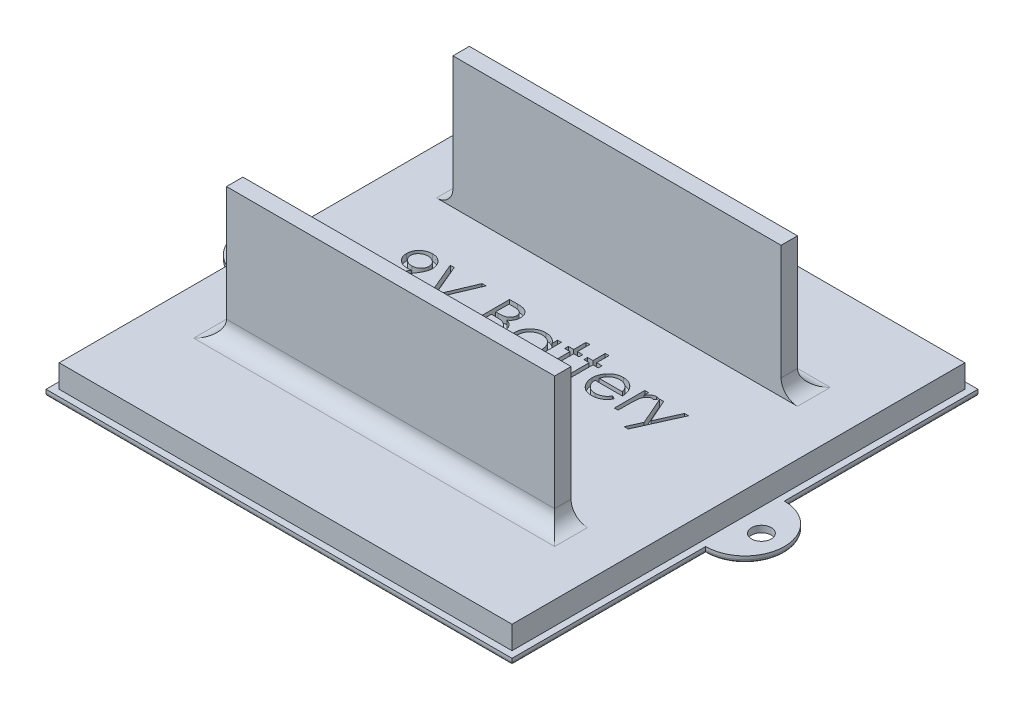
from build123d import *

# Parameters (mm, degrees)
SKETCH1_W            = 71
SKETCH1_H            = 71
BOSS_EXTRUDE1_DEPTH  = 4.5
TEXT_2_W             = 0.569871795
TEXT_2_H             = 6.512820513
CUT_EXTRUDE1_DEPTH   = 1
BOSS_EXTRUDE3_DEPTH  = 4.5
SKETCH5_R            = 1.5
CUT_EXTRUDE2_DEPTH   = 4.5
SKETCH61_W           = 89
SKETCH61_H           = 89
SKETCH61_W_2         = 69
SKETCH61_H_2         = 69
CUT_EXTRUDE21_DEPTH  = 3.5
SKETCH9_W            = 50
SKETCH9_H            = 2.5
TOP_TRACK_DEPTH      = 20
FILLET1_R            = 2.5
FILLET1_OF_MIRROR4_R = 2.5
FILLET2_R            = 0.5


with BuildPart() as part:
    # Sketch1 → Boss-Extrude1 (new body)
    with BuildSketch(Plane(origin=(0, 0, 0), x_dir=(1, 0, 0), z_dir=(0, 1, 0))):
        Rectangle(SKETCH1_W, SKETCH1_H)
    extrude(amount=BOSS_EXTRUDE1_DEPTH)

    # text 2 → Cut-Extrude1 (cut)
    # profile 1 of 15: a face of its own
    with BuildSketch(Plane(origin=(0, 4.5, 0), x_dir=(1, 0, 0), z_dir=(0, 1, 0))):
        with BuildLine():
            Line((-21.152394286, 1.65489819), (-21.607782908, 1.971634969))
            Line((-21.607782908, 1.971634969), (-19.842197972, 4.552594504))
            add(Edge.make_bspline(
                [(-19.842197972, 4.552594504), (-19.954848307, 4.538818518), (-20.176663096, 4.511692833), (-20.400068981, 4.506709616), (-20.510016482, 4.504257164)],
                knots=[0, 0, 0, 0, 1.015715272, 2, 2, 2, 2], degree=3))
            add(Edge.make_bspline(
                [(-20.510016482, 4.504257164), (-20.576677054, 4.505964546), (-20.707525928, 4.509315987), (-20.899897641, 4.53588041), (-21.084747158, 4.576792785), (-21.261584418, 4.63784124), (-21.431074091, 4.71371142), (-21.592846171, 4.807794859), (-21.746682887, 4.918477702), (-21.890932045, 5.045174701), (-22.0221262, 5.184290596), (-22.139008468, 5.33153012), (-22.236147379, 5.488603667), (-22.316840613, 5.652307065), (-22.378037293, 5.82499323), (-22.422600754, 6.004697142), (-22.450037025, 6.192678264), (-22.453301099, 6.320631001), (-22.454958389, 6.385597308)],
                knots=[0, 0, 0, 0, 1.060718605, 2.082097864, 3.085795603, 4.069760067, 5.054557537, 6.03741023, 7.043284206, 8.066802108, 9.088538119, 10.083643548, 11.053783639, 12.022749082, 12.983451788, 13.964007469, 14.966251758, 16, 16, 16, 16], degree=3))
            add(Edge.make_bspline(
                [(-22.454958389, 6.385597308), (-22.451811628, 6.474440436), (-22.445635176, 6.648821471), (-22.395926438, 6.903608452), (-22.314174108, 7.144521181), (-22.200185482, 7.370926248), (-22.056612487, 7.579566817), (-21.884058331, 7.767542437), (-21.683572567, 7.932179529), (-21.459722332, 8.073701212), (-21.217781852, 8.187520421), (-20.964383001, 8.271411724), (-20.701467383, 8.320758023), (-20.523363181, 8.3272638), (-20.433694366, 8.330539216)],
                knots=[0, 0, 0, 0, 1.022988612, 2.007919123, 2.978103895, 3.94594894, 4.918897164, 5.887013414, 6.875921846, 7.89917871, 8.930658928, 9.948724884, 10.967259574, 12, 12, 12, 12], degree=3))
            add(Edge.make_bspline(
                [(-20.433694366, 8.330539216), (-20.345722519, 8.327218777), (-20.171898441, 8.320657903), (-19.91628553, 8.272608416), (-19.67146397, 8.191624738), (-19.438790923, 8.079711316), (-19.223363704, 7.939429097), (-19.029641875, 7.772270747), (-18.862046254, 7.578132148), (-18.720851499, 7.361708744), (-18.607512997, 7.129177221), (-18.525738998, 6.886454962), (-18.475400482, 6.635287568), (-18.469057145, 6.465117593), (-18.465855825, 6.379237132)],
                knots=[0, 0, 0, 0, 1.026385292, 2.028040595, 3.023318987, 4.028184125, 5.03290303, 6.015178782, 7.004435299, 8.016004309, 9.023023918, 10.015172535, 10.998308025, 12, 12, 12, 12], degree=3))
            add(Edge.make_bspline(
                [(-18.465855825, 6.379237132), (-18.467993795, 6.31257344), (-18.472330133, 6.177362817), (-18.502694576, 5.971930623), (-18.554256912, 5.762469107), (-18.612770709, 5.585174212), (-18.669253356, 5.438746024), (-18.72241398, 5.323082443), (-18.781400316, 5.20134158), (-18.85019579, 5.074799981), (-18.924150243, 4.941844525), (-19.007714931, 4.803808741), (-19.098983611, 4.660507396), (-19.163988959, 4.563901965), (-19.197276097, 4.514433446)],
                knots=[0, 0, 0, 0, 1.179839688, 2.393009684, 3.667231171, 4.993948276, 5.694988576, 6.444077775, 7.246288328, 8.089075292, 8.993003841, 9.939041771, 10.944649915, 12, 12, 12, 12], degree=3))
            Line((-19.197276097, 4.514433446), (-21.152394286, 1.65489819))
        make_face()
        with BuildLine():
            add(Edge.make_bspline(
                [(-20.404437555, 5.155539216), (-20.353938701, 5.156918769), (-20.2556346, 5.15960429), (-20.1116215, 5.175949629), (-19.975687588, 5.204931004), (-19.84746975, 5.24651391), (-19.725682371, 5.29669101), (-19.61225989, 5.360575613), (-19.507107382, 5.436805793), (-19.409520714, 5.52245825), (-19.322863172, 5.617618595), (-19.245677959, 5.717217631), (-19.180072358, 5.821692566), (-19.128250412, 5.932351771), (-19.085642683, 6.046501563), (-19.056218575, 6.165980179), (-19.039918428, 6.290165135), (-19.037139713, 6.374526986), (-19.035727619, 6.41739819)],
                knots=[0, 0, 0, 0, 1.163407946, 2.26475976, 3.333800367, 4.359385343, 5.366239384, 6.363380779, 7.350133999, 8.353570782, 9.349036268, 10.310270964, 11.253520213, 12.184142, 13.120487599, 14.056272588, 15.012232024, 16, 16, 16, 16], degree=3))
            add(Edge.make_bspline(
                [(-19.035727619, 6.41739819), (-19.036942591, 6.460287297), (-19.039336841, 6.544805543), (-19.058545227, 6.669174357), (-19.092336703, 6.788360701), (-19.137676583, 6.903017081), (-19.1974033, 7.01220147), (-19.26907391, 7.117284666), (-19.354222783, 7.217600384), (-19.452198867, 7.310789325), (-19.557852985, 7.396691943), (-19.670448464, 7.472503823), (-19.78905724, 7.536042279), (-19.9129557, 7.588473268), (-20.04240199, 7.629388632), (-20.177319512, 7.658811565), (-20.318390033, 7.675088891), (-20.414150367, 7.677850043), (-20.462951177, 7.679257164)],
                knots=[0, 0, 0, 0, 0.972161553, 1.915763587, 2.844109794, 3.775983486, 4.705125789, 5.659731448, 6.655561913, 7.682237399, 8.721216875, 9.739758359, 10.754845918, 11.767244016, 12.7857855, 13.828538656, 14.893392813, 16, 16, 16, 16], degree=3))
            add(Edge.make_bspline(
                [(-20.462951177, 7.679257164), (-20.51132757, 7.67784777), (-20.606241653, 7.675082549), (-20.746058057, 7.658842505), (-20.880063319, 7.629190755), (-21.009134544, 7.58849222), (-21.133029323, 7.536038368), (-21.251632505, 7.472500494), (-21.364254321, 7.396709394), (-21.469807143, 7.310721735), (-21.56795623, 7.218034148), (-21.651641118, 7.116845213), (-21.723475751, 7.012256133), (-21.783120399, 6.903002554), (-21.828482109, 6.788364578), (-21.86226774, 6.669173306), (-21.881477697, 6.544805816), (-21.883871732, 6.460287389), (-21.885086594, 6.41739819)],
                knots=[0, 0, 0, 0, 1.099389452, 2.15699305, 3.192601482, 4.213358962, 5.227959689, 6.245255729, 7.266013209, 8.307253147, 9.336162325, 10.327954924, 11.284637477, 12.215801273, 13.149702402, 14.080068371, 15.025723358, 16, 16, 16, 16], degree=3))
            add(Edge.make_bspline(
                [(-21.885086594, 6.41739819), (-21.883987271, 6.374493601), (-21.881819204, 6.289877898), (-21.8609045, 6.165551443), (-21.825928192, 6.046374291), (-21.779084441, 5.931187637), (-21.717395842, 5.821111551), (-21.64169686, 5.716667909), (-21.552968227, 5.616672735), (-21.452396042, 5.52267965), (-21.342326664, 5.436406418), (-21.224766854, 5.361058439), (-21.101740435, 5.297427004), (-20.972814334, 5.246370493), (-20.838943997, 5.205346475), (-20.698926258, 5.176003043), (-20.55322417, 5.159761073), (-20.454508918, 5.156960003), (-20.404437555, 5.155539216)],
                knots=[0, 0, 0, 0, 0.952633368, 1.87876736, 2.791047057, 3.707742249, 4.635551637, 5.587206343, 6.568248508, 7.601284464, 8.641511608, 9.671105535, 10.699146789, 11.713763218, 12.747829548, 13.806491675, 14.887386225, 16, 16, 16, 16], degree=3))
        make_face(mode=Mode.SUBTRACT)
    # profile 2 of 15: a face of its own
    with BuildSketch(Plane(origin=(0, 4.5, 0), x_dir=(1, 0, 0), z_dir=(0, 1, 0))):
        Polygon((-17.570343004, 8.167718703), (-16.959766081, 8.167718703), (-14.843099414, 3.163532004), (-12.726432748, 8.167718703), (-12.115855825, 8.167718703), (-14.802394286, 1.817718703), (-14.883804543, 1.817718703), align=None)
    # profile 3 of 15: a face of its own
    with BuildSketch(Plane(origin=(0, 4.5, 0), x_dir=(1, 0, 0), z_dir=(0, 1, 0))):
        with BuildLine():
            Line((-8.533804543, 8.167718703), (-7.294842203, 8.167718703))
            add(Edge.make_bspline(
                [(-7.294842203, 8.167718703), (-7.234193392, 8.167399841), (-7.116640904, 8.166781808), (-6.945699916, 8.157196699), (-6.78559136, 8.144127184), (-6.636268801, 8.12338973), (-6.497801241, 8.098367506), (-6.369771385, 8.068065639), (-6.252586358, 8.03173164), (-6.112681822, 7.973953387), (-5.953168623, 7.888095639), (-5.780451539, 7.761225242), (-5.632760991, 7.606044916), (-5.505422958, 7.430997813), (-5.404183784, 7.238437198), (-5.330942345, 7.03295267), (-5.284573056, 6.817194653), (-5.279804326, 6.669070601), (-5.277394286, 6.594211091)],
                knots=[0, 0, 0, 0, 1.001505555, 1.941167018, 2.826882275, 3.653841531, 4.429895133, 5.150066043, 5.825578002, 6.45369114, 7.647487171, 8.808567382, 9.977351308, 11.170798116, 12.373658725, 13.556498008, 14.765093433, 16, 16, 16, 16], degree=3))
            add(Edge.make_bspline(
                [(-5.277394286, 6.594211091), (-5.279377697, 6.524084311), (-5.283275286, 6.386278576), (-5.32054572, 6.18472212), (-5.378894362, 5.992859195), (-5.460002457, 5.81139001), (-5.565416078, 5.64441474), (-5.690344742, 5.490586415), (-5.841069798, 5.356418068), (-5.953996819, 5.281410231), (-6.011358629, 5.243309648)],
                knots=[0, 0, 0, 0, 1.044552857, 2.05264487, 3.044412934, 4.028983338, 5.005914585, 5.980388656, 6.974128949, 8, 8, 8, 8], degree=3))
            add(Edge.make_bspline(
                [(-6.011358629, 5.243309648), (-5.939221853, 5.215614579), (-5.801206332, 5.16262705), (-5.611275995, 5.068945566), (-5.447636776, 4.967051451), (-5.309030525, 4.855777951), (-5.190489352, 4.73583768), (-5.086979015, 4.605471973), (-4.998657093, 4.462980227), (-4.922977932, 4.309848098), (-4.863925189, 4.14763922), (-4.819700334, 3.977875098), (-4.79435939, 3.801164476), (-4.790753241, 3.680903859), (-4.788932748, 3.620192661)],
                knots=[0, 0, 0, 0, 1.27268992, 2.434971085, 3.483601985, 4.442670788, 5.356604649, 6.2567628, 7.179492994, 8.113709626, 9.066344395, 10.018646069, 10.999752585, 12, 12, 12, 12], degree=3))
            add(Edge.make_bspline(
                [(-4.788932748, 3.620192661), (-4.790705025, 3.558204193), (-4.794192032, 3.436240146), (-4.819918552, 3.257070116), (-4.863477932, 3.085846998), (-4.92347844, 2.92146331), (-5.001787211, 2.764237066), (-5.097087946, 2.613990144), (-5.210719497, 2.472232144), (-5.33783356, 2.337387857), (-5.481637738, 2.216143157), (-5.63678775, 2.10816466), (-5.805237502, 2.019362519), (-5.984220406, 1.944766309), (-6.175744236, 1.887784677), (-6.378948967, 1.84792015), (-6.593659343, 1.821059583), (-6.740997034, 1.818851226), (-6.816556946, 1.817718703)],
                knots=[0, 0, 0, 0, 0.978564426, 1.925352924, 2.850884081, 3.763762016, 4.682927383, 5.618979971, 6.567305752, 7.547517671, 8.540179244, 9.531824382, 10.526200242, 11.540722885, 12.589160233, 13.674978461, 14.80764778, 16, 16, 16, 16], degree=3))
            Line((-6.816556946, 1.817718703), (-8.533804543, 1.817718703))
            Line((-8.533804543, 1.817718703), (-8.533804543, 8.167718703))
        make_face()
        with BuildLine():
            Line((-7.963932748, 7.516436651), (-7.963932748, 5.481180241))
            Line((-7.963932748, 5.481180241), (-7.581050135, 5.481180241))
            add(Edge.make_bspline(
                [(-7.581050135, 5.481180241), (-7.525081607, 5.481905816), (-7.416939004, 5.483307774), (-7.260330048, 5.487323726), (-7.114960372, 5.498568748), (-6.981080904, 5.509810538), (-6.85890247, 5.528088718), (-6.74869575, 5.549845855), (-6.648731152, 5.572856269), (-6.533452263, 5.611989481), (-6.402691342, 5.669824691), (-6.263294139, 5.759580737), (-6.140404458, 5.866486349), (-6.036632418, 5.98984138), (-5.951703035, 6.125670031), (-5.892713866, 6.271805086), (-5.852713794, 6.424604468), (-5.849100587, 6.529503298), (-5.847266081, 6.582762773)],
                knots=[0, 0, 0, 0, 1.156816544, 2.235205308, 3.236616184, 4.169592532, 5.011045266, 5.787822928, 6.49130361, 7.128639758, 8.301311294, 9.436451833, 10.541879658, 11.654887649, 12.756523258, 13.837046038, 14.901820046, 16, 16, 16, 16], degree=3))
            add(Edge.make_bspline(
                [(-5.847266081, 6.582762773), (-5.848220722, 6.618006673), (-5.850093355, 6.687141431), (-5.865430061, 6.787923831), (-5.891496946, 6.882708924), (-5.924978307, 6.972795667), (-5.971766356, 7.055367167), (-6.026854354, 7.133278394), (-6.093412678, 7.203876094), (-6.169172374, 7.269860756), (-6.256273732, 7.328361542), (-6.35466479, 7.379598355), (-6.465676719, 7.420856621), (-6.587438613, 7.456990212), (-6.721824729, 7.482368974), (-6.867284276, 7.503511548), (-7.025008694, 7.514275238), (-7.134129095, 7.51570011), (-7.190535312, 7.516436651)],
                knots=[0, 0, 0, 0, 0.91205012, 1.789085906, 2.630437955, 3.453916878, 4.269457761, 5.079663411, 5.91843418, 6.774407191, 7.675494373, 8.627863946, 9.638891023, 10.736472738, 11.911756761, 13.175263542, 14.539845004, 16, 16, 16, 16], degree=3))
            Line((-7.190535312, 7.516436651), (-7.963932748, 7.516436651))
        make_face(mode=Mode.SUBTRACT)
        with BuildLine():
            Line((-7.963932748, 4.82989819), (-7.963932748, 2.469000754))
            Line((-7.963932748, 2.469000754), (-7.152374254, 2.469000754))
            add(Edge.make_bspline(
                [(-7.152374254, 2.469000754), (-7.094282774, 2.469696981), (-6.982319105, 2.471038868), (-6.820664016, 2.47541956), (-6.670834671, 2.485384117), (-6.533514767, 2.501070159), (-6.407221518, 2.518085345), (-6.293469971, 2.540965812), (-6.191338034, 2.567180355), (-6.07291179, 2.607700924), (-5.939555425, 2.670650236), (-5.7958443, 2.765563189), (-5.668071018, 2.878635476), (-5.559567191, 3.009501563), (-5.470643626, 3.151798399), (-5.405954443, 3.30264782), (-5.366056746, 3.459557277), (-5.36122681, 3.566539741), (-5.358804543, 3.620192661)],
                knots=[0, 0, 0, 0, 1.160039823, 2.235823828, 3.228722157, 4.157150951, 4.99529583, 5.772374946, 6.472645482, 7.099169577, 8.269452708, 9.405989375, 10.527446681, 11.663510218, 12.788923519, 13.866172445, 14.929861265, 16, 16, 16, 16], degree=3))
            add(Edge.make_bspline(
                [(-5.358804543, 3.620192661), (-5.359305475, 3.653744865), (-5.360299259, 3.720308072), (-5.375286375, 3.818126772), (-5.397082967, 3.912879428), (-5.425261426, 4.004823329), (-5.466299602, 4.092296168), (-5.514208619, 4.177027955), (-5.570381448, 4.259130696), (-5.657910149, 4.36293007), (-5.785222178, 4.482522365), (-5.966118756, 4.599611834), (-6.171808497, 4.694041426), (-6.320992662, 4.734136191), (-6.398057347, 4.75484811)],
                knots=[0, 0, 0, 0, 0.723448775, 1.435228256, 2.130040452, 2.821711965, 3.505591119, 4.210454504, 4.921174351, 5.648778258, 7.137944449, 8.670945889, 10.280296675, 12, 12, 12, 12], degree=3))
            add(Edge.make_bspline(
                [(-6.398057347, 4.75484811), (-6.428952992, 4.761116619), (-6.495941124, 4.774708041), (-6.605174877, 4.789054874), (-6.729881382, 4.801836626), (-6.870348602, 4.811291154), (-7.026754257, 4.821063883), (-7.199432381, 4.824864488), (-7.387677795, 4.829398859), (-7.518292527, 4.829727489), (-7.586138277, 4.82989819)],
                knots=[0, 0, 0, 0, 0.634451884, 1.375622551, 2.216452059, 3.157844607, 4.20941857, 5.370758133, 6.634282058, 8, 8, 8, 8], degree=3))
            Line((-7.586138277, 4.82989819), (-7.963932748, 4.82989819))
        make_face(mode=Mode.SUBTRACT)
    # profile 4 of 15: a face of its own
    with BuildSketch(Plane(origin=(0, 4.5, 0), x_dir=(1, 0, 0), z_dir=(0, 1, 0))):
        with BuildLine():
            Line((1.072605714, 6.458103318), (1.072605714, 1.817718703))
            Line((1.072605714, 1.817718703), (0.502733919, 1.817718703))
            Line((0.502733919, 1.817718703), (0.502733919, 2.62037295))
            add(Edge.make_bspline(
                [(0.502733919, 2.62037295), (0.438474113, 2.547729686), (0.313070294, 2.405965444), (0.103627123, 2.220759217), (-0.118383714, 2.067672834), (-0.351884683, 1.944029415), (-0.596664924, 1.851152399), (-0.852181825, 1.78513751), (-1.118539616, 1.742694409), (-1.300426031, 1.738456198), (-1.392598613, 1.736308446)],
                knots=[0, 0, 0, 0, 1.074387032, 2.096679803, 3.090159297, 4.057316773, 5.018401886, 5.985159533, 6.978961417, 8, 8, 8, 8], degree=3))
            add(Edge.make_bspline(
                [(-1.392598613, 1.736308446), (-1.474546186, 1.738533436), (-1.63615043, 1.742921214), (-1.873874612, 1.776961394), (-2.102641979, 1.83162695), (-2.322668704, 1.907647135), (-2.532531025, 2.008486626), (-2.734025772, 2.129211462), (-2.926109084, 2.272976968), (-3.105853162, 2.437329533), (-3.271374077, 2.615846153), (-3.4166281, 2.806247359), (-3.53773726, 3.007709825), (-3.639010835, 3.217682833), (-3.717018488, 3.437782758), (-3.771399225, 3.667248477), (-3.805399749, 3.905808676), (-3.809785714, 4.068258954), (-3.812009671, 4.150631363)],
                knots=[0, 0, 0, 0, 1.033919861, 2.038935746, 3.024066025, 3.998881131, 4.97069526, 5.957263378, 6.95902576, 7.993208707, 9.027059324, 10.027763471, 11.009749337, 11.988697705, 12.965288445, 13.950418724, 14.960734635, 16, 16, 16, 16], degree=3))
            add(Edge.make_bspline(
                [(-3.812009671, 4.150631363), (-3.809736423, 4.231301225), (-3.805242334, 4.390781191), (-3.771762921, 4.625329686), (-3.715463805, 4.851241387), (-3.636455567, 5.067788984), (-3.535142306, 5.275234504), (-3.411901348, 5.473724664), (-3.266723793, 5.663806285), (-3.099351569, 5.841009796), (-2.918041343, 6.004695768), (-2.72407836, 6.146952179), (-2.52228755, 6.26980989), (-2.309538945, 6.367152626), (-2.088981483, 6.445909144), (-1.85865166, 6.500397529), (-1.619507796, 6.532505526), (-1.457146475, 6.537155113), (-1.374790119, 6.539513575)],
                knots=[0, 0, 0, 0, 1.020392517, 2.01726096, 2.990465484, 3.961182959, 4.928053699, 5.906110375, 6.912531644, 7.948652711, 8.985773172, 9.998621852, 10.987621588, 11.969261332, 12.953316658, 13.946091881, 14.958173133, 16, 16, 16, 16], degree=3))
            add(Edge.make_bspline(
                [(-1.374790119, 6.539513575), (-1.280084661, 6.536905082), (-1.094371726, 6.531789953), (-0.822722338, 6.489221862), (-0.565738785, 6.417306357), (-0.321437318, 6.31948461), (-0.090695216, 6.189493345), (0.124303055, 6.025518273), (0.325807575, 5.828593548), (0.442611819, 5.677335741), (0.502733919, 5.59947952)],
                knots=[0, 0, 0, 0, 1.038897134, 2.037228247, 3.008116434, 3.962042015, 4.918381754, 5.904844433, 6.921570401, 8, 8, 8, 8], degree=3))
            Line((0.502733919, 5.59947952), (0.502733919, 6.458103318))
            Line((0.502733919, 6.458103318), (1.072605714, 6.458103318))
        make_face()
        with BuildLine():
            add(Edge.make_bspline(
                [(-1.367157908, 5.96964178), (-1.450459635, 5.966677894), (-1.614883995, 5.960827655), (-1.856263827, 5.915155743), (-2.087246736, 5.839165121), (-2.306677471, 5.735239386), (-2.511089807, 5.604558679), (-2.693776895, 5.446495597), (-2.856232939, 5.265362729), (-2.992863647, 5.061977472), (-3.104243548, 4.843940078), (-3.182560878, 4.616021454), (-3.234212227, 4.382332424), (-3.239489114, 4.223831551), (-3.242137876, 4.144271187)],
                knots=[0, 0, 0, 0, 1.031046209, 2.035121221, 3.029706178, 4.034933723, 5.034054252, 6.02443088, 7.017295772, 8.038157696, 9.050218397, 10.03989886, 11.016116709, 12, 12, 12, 12], degree=3))
            add(Edge.make_bspline(
                [(-3.242137876, 4.144271187), (-3.238754427, 4.065186278), (-3.23200079, 3.907326447), (-3.183467387, 3.673318829), (-3.102042474, 3.445346495), (-2.990931875, 3.225344407), (-2.851800427, 3.021084682), (-2.690531014, 2.836499031), (-2.505564075, 2.677767921), (-2.300681313, 2.544894037), (-2.081863995, 2.437556321), (-1.851751005, 2.362870089), (-1.614668061, 2.314650402), (-1.453464541, 2.309017994), (-1.372246049, 2.306180241)],
                knots=[0, 0, 0, 0, 0.979072187, 1.954306742, 2.945804271, 3.96968567, 4.997920485, 5.998718438, 6.996577872, 8.005894225, 9.015743152, 10.005417472, 10.995077863, 12, 12, 12, 12], degree=3))
            add(Edge.make_bspline(
                [(-1.372246049, 2.306180241), (-1.289793108, 2.30919189), (-1.125802387, 2.315181761), (-0.883706446, 2.361049199), (-0.648765584, 2.436829733), (-0.424180184, 2.541875292), (-0.214963775, 2.672063638), (-0.027189054, 2.824476503), (0.131589917, 3.001737994), (0.266196509, 3.196549559), (0.371743336, 3.410112752), (0.448625615, 3.637504784), (0.494080558, 3.87873357), (0.499809582, 4.043586695), (0.502733919, 4.127734728)],
                knots=[0, 0, 0, 0, 1.01762866, 2.023962475, 3.030623092, 4.058876274, 5.077231937, 6.066672613, 7.034107872, 8.005628644, 8.981990164, 9.965428785, 10.961468474, 12, 12, 12, 12], degree=3))
            add(Edge.make_bspline(
                [(0.502733919, 4.127734728), (0.500992828, 4.191847649), (0.49756581, 4.318042167), (0.471384634, 4.503330663), (0.429737839, 4.680647566), (0.371052645, 4.850179302), (0.293961315, 5.010988544), (0.200983225, 5.164229938), (0.090483338, 5.309106478), (-0.035759554, 5.443623193), (-0.173944993, 5.566316917), (-0.320166516, 5.675834897), (-0.476156529, 5.765803099), (-0.639291724, 5.840263691), (-0.809855145, 5.899516721), (-0.989234698, 5.939045822), (-1.175523718, 5.966188119), (-1.302607275, 5.968478438), (-1.367157908, 5.96964178)],
                knots=[0, 0, 0, 0, 1.050140795, 2.067009409, 3.05949893, 4.030605086, 5.00011959, 5.97591094, 6.962425594, 7.979863591, 8.993523472, 9.986985069, 10.967611495, 11.937549037, 12.921786183, 13.919465291, 14.943216303, 16, 16, 16, 16], degree=3))
        make_face(mode=Mode.SUBTRACT)
    # profile 5 of 15: a face of its own
    with BuildSketch(Plane(origin=(0, 4.5, 0), x_dir=(1, 0, 0), z_dir=(0, 1, 0))):
        Polygon((2.945041611, 8.330539216), (3.514913406, 8.330539216), (3.514913406, 6.458103318), (4.32901597, 6.458103318), (4.32901597, 5.888231523), (3.514913406, 5.888231523), (3.514913406, 1.817718703), (2.945041611, 1.817718703), (2.945041611, 5.888231523), (2.130939047, 5.888231523), (2.130939047, 6.458103318), (2.945041611, 6.458103318), align=None)
    # profile 6 of 15: a face of its own
    with BuildSketch(Plane(origin=(0, 4.5, 0), x_dir=(1, 0, 0), z_dir=(0, 1, 0))):
        Polygon((5.875810842, 8.330539216), (6.445682637, 8.330539216), (6.445682637, 6.458103318), (7.259785201, 6.458103318), (7.259785201, 5.888231523), (6.445682637, 5.888231523), (6.445682637, 1.817718703), (5.875810842, 1.817718703), (5.875810842, 5.888231523), (5.061708278, 5.888231523), (5.061708278, 6.458103318), (5.875810842, 6.458103318), align=None)
    # profile 7 of 15: a face of its own
    with BuildSketch(Plane(origin=(0, 4.5, 0), x_dir=(1, 0, 0), z_dir=(0, 1, 0))):
        with BuildLine():
            Line((12.045181836, 3.283103318), (12.551451868, 3.01724795))
            add(Edge.make_bspline(
                [(12.551451868, 3.01724795), (12.511108331, 2.945686477), (12.432615784, 2.806456191), (12.29763157, 2.615172672), (12.156131667, 2.443091816), (12.001728753, 2.294810872), (11.839042336, 2.165540502), (11.667170234, 2.052441877), (11.485217664, 1.956069705), (11.293176021, 1.874875833), (11.089432549, 1.812447179), (10.873493512, 1.768352378), (10.644945228, 1.741095877), (10.488288587, 1.737929693), (10.408072461, 1.736308446)],
                knots=[0, 0, 0, 0, 1.120438281, 2.179929193, 3.190490725, 4.156257408, 5.095198341, 6.022838206, 6.959905092, 7.901321166, 8.864066838, 9.862729781, 10.905609505, 12, 12, 12, 12], degree=3))
            add(Edge.make_bspline(
                [(10.408072461, 1.736308446), (10.318914873, 1.73838975), (10.144994248, 1.742449771), (9.891829278, 1.777451814), (9.653469476, 1.834551664), (9.429928243, 1.914317718), (9.221753014, 2.018507292), (9.028530034, 2.14543378), (8.84924318, 2.294445157), (8.689542115, 2.466832133), (8.54577107, 2.651312255), (8.418905654, 2.843546503), (8.312847172, 3.04305121), (8.226573151, 3.248556304), (8.156895753, 3.458766511), (8.108333305, 3.675594459), (8.080339333, 3.898453304), (8.076049554, 4.049215614), (8.073887765, 4.125190658)],
                knots=[0, 0, 0, 0, 1.145258523, 2.234067595, 3.276747158, 4.290159414, 5.277019952, 6.260822364, 7.254936242, 8.264827045, 9.274100331, 10.257902744, 11.220704747, 12.172965371, 13.118907548, 14.062713208, 15.023725156, 16, 16, 16, 16], degree=3))
            add(Edge.make_bspline(
                [(8.073887765, 4.125190658), (8.07580935, 4.196482707), (8.079617678, 4.337774135), (8.103622106, 4.546898765), (8.14616401, 4.750150386), (8.204541054, 4.947697885), (8.279926887, 5.139210499), (8.372151056, 5.324804786), (8.481357227, 5.504283254), (8.565671935, 5.617500368), (8.608142573, 5.6745296)],
                knots=[0, 0, 0, 0, 1.024358464, 2.0301432, 3.019427413, 4.004406732, 4.986367066, 5.972626655, 6.978780325, 8, 8, 8, 8], degree=3))
            add(Edge.make_bspline(
                [(8.608142573, 5.6745296), (8.665669369, 5.74323455), (8.778900658, 5.878468052), (8.970410045, 6.056156157), (9.177783259, 6.205007006), (9.398421494, 6.328391382), (9.634889097, 6.422142141), (9.884007383, 6.492005898), (10.148612946, 6.531154575), (10.329506704, 6.536684216), (10.422064848, 6.539513575)],
                knots=[0, 0, 0, 0, 1.030682036, 2.02871468, 2.997146059, 3.962720338, 4.930598197, 5.918074684, 6.934738563, 8, 8, 8, 8], degree=3))
            add(Edge.make_bspline(
                [(10.422064848, 6.539513575), (10.51721979, 6.537056943), (10.703892093, 6.532237592), (10.976093227, 6.487558387), (11.233650527, 6.416705895), (11.476460927, 6.316641161), (11.704549046, 6.187537403), (11.916432308, 6.027622919), (12.115734338, 5.841807246), (12.231682759, 5.698908281), (12.29068464, 5.62619226)],
                knots=[0, 0, 0, 0, 1.056321875, 2.072262726, 3.055038591, 4.01806755, 4.982017516, 5.957941055, 6.960871419, 8, 8, 8, 8], degree=3))
            add(Edge.make_bspline(
                [(12.29068464, 5.62619226), (12.330829228, 5.571394334), (12.41085119, 5.462163233), (12.511085214, 5.284052705), (12.598093631, 5.097706341), (12.667640575, 4.900111945), (12.723955098, 4.693610707), (12.764698184, 4.476726376), (12.788591634, 4.249523536), (12.793288271, 4.094716786), (12.795682637, 4.015795626)],
                knots=[0, 0, 0, 0, 0.94817472, 1.890038105, 2.849395472, 3.817997239, 4.812318967, 5.836947057, 6.897266129, 8, 8, 8, 8], degree=3))
            Line((12.795682637, 4.015795626), (8.64375956, 4.015795626))
            add(Edge.make_bspline(
                [(8.64375956, 4.015795626), (8.646552846, 3.954653355), (8.65204573, 3.834419545), (8.677654633, 3.658486839), (8.718020265, 3.490895204), (8.774751279, 3.332901685), (8.843452555, 3.182442739), (8.927609498, 3.040634472), (9.028011261, 2.908122799), (9.139999315, 2.783722421), (9.264653617, 2.672940754), (9.395795172, 2.573786817), (9.535302069, 2.490682377), (9.682074306, 2.423227435), (9.835874545, 2.370420261), (9.996751242, 2.334374358), (10.164387824, 2.310231464), (10.278661942, 2.307546929), (10.336838486, 2.306180241)],
                knots=[0, 0, 0, 0, 1.094153842, 2.151609401, 3.174256925, 4.172055639, 5.149267565, 6.128595816, 7.11444997, 8.118368179, 9.117203808, 10.09244225, 11.054858984, 12.015122123, 12.976791628, 13.957293641, 14.960065497, 16, 16, 16, 16], degree=3))
            add(Edge.make_bspline(
                [(10.336838486, 2.306180241), (10.393718426, 2.30728343), (10.506579136, 2.309472367), (10.67465612, 2.330757406), (10.840009263, 2.365174906), (11.00195419, 2.412146745), (11.157204153, 2.469436177), (11.300978222, 2.538565647), (11.433203756, 2.61503733), (11.556787396, 2.702503455), (11.676659055, 2.809561166), (11.795571852, 2.943157402), (11.92307378, 3.10115906), (12.00288347, 3.220077625), (12.045181836, 3.283103318)],
                knots=[0, 0, 0, 0, 0.99110716, 1.966546729, 2.947904876, 3.932708344, 4.903319531, 5.828989031, 6.710028674, 7.56322171, 8.463672341, 9.504779593, 10.677557249, 12, 12, 12, 12], degree=3))
        make_face()
        with BuildLine():
            add(Edge.make_bspline(
                [(12.225810842, 4.585667421), (12.20495268, 4.661255777), (12.164807433, 4.806739032), (12.080921458, 5.008198933), (11.986448805, 5.187246982), (11.874649379, 5.342512888), (11.747978262, 5.480404976), (11.601664859, 5.600907266), (11.43758831, 5.708707498), (11.256596726, 5.799698462), (11.064932344, 5.877150063), (10.86426111, 5.929084201), (10.659504838, 5.964661514), (10.521012633, 5.967974596), (10.451321659, 5.96964178)],
                knots=[0, 0, 0, 0, 1.154881502, 2.222775134, 3.210006277, 4.132804581, 5.035138423, 5.962687519, 6.919655026, 7.923214229, 8.944639381, 9.960483929, 10.97369054, 12, 12, 12, 12], degree=3))
            add(Edge.make_bspline(
                [(10.451321659, 5.96964178), (10.394444821, 5.968532033), (10.282011269, 5.966338296), (10.116365045, 5.945528205), (9.95728902, 5.911129629), (9.803609427, 5.864021779), (9.657340137, 5.801231886), (9.515472486, 5.727602318), (9.381613767, 5.63771973), (9.297900274, 5.569214379), (9.255608518, 5.534605722)],
                knots=[0, 0, 0, 0, 1.04873581, 2.073130211, 3.073294108, 4.04793562, 5.032784715, 6.005352987, 6.992311501, 8, 8, 8, 8], degree=3))
            add(Edge.make_bspline(
                [(9.255608518, 5.534605722), (9.225322135, 5.507220321), (9.164029878, 5.451798943), (9.082132074, 5.356314525), (9.003717788, 5.253350977), (8.932355304, 5.138969108), (8.866900254, 5.014471409), (8.80565001, 4.880907985), (8.750520376, 4.737265306), (8.719503148, 4.637166738), (8.703545217, 4.585667421)],
                knots=[0, 0, 0, 0, 0.879870761, 1.780643979, 2.707998968, 3.669668524, 4.684282772, 5.740141944, 6.837334558, 8, 8, 8, 8], degree=3))
            Line((8.703545217, 4.585667421), (12.225810842, 4.585667421))
        make_face(mode=Mode.SUBTRACT)
    # profile 8 of 15: a face of its own
    with BuildSketch(Plane(origin=(0, 4.5, 0), x_dir=(1, 0, 0), z_dir=(0, 1, 0))):
        with BuildLine():
            Line((13.772605714, 6.458103318), (14.342477509, 6.458103318))
            Line((14.342477509, 6.458103318), (14.342477509, 5.775020385))
            add(Edge.make_bspline(
                [(14.342477509, 5.775020385), (14.384548542, 5.838621674), (14.465009068, 5.960258644), (14.598745382, 6.12113009), (14.735729998, 6.25432596), (14.876618695, 6.360468059), (15.022447533, 6.439957574), (15.170016003, 6.498183509), (15.321645784, 6.532613781), (15.42353956, 6.537210563), (15.474588887, 6.539513575)],
                knots=[0, 0, 0, 0, 1.2804753, 2.448899062, 3.506932113, 4.484331642, 5.4025378, 6.288909075, 7.142734305, 8, 8, 8, 8], degree=3))
            add(Edge.make_bspline(
                [(15.474588887, 6.539513575), (15.514188079, 6.537353619), (15.595665991, 6.532909371), (15.719005833, 6.501684017), (15.846084667, 6.451831033), (15.927985855, 6.404949487), (15.970682637, 6.380509167)],
                knots=[0, 0, 0, 0, 0.901110191, 1.854092781, 2.881294221, 4, 4, 4, 4], degree=3))
            Line((15.970682637, 6.380509167), (15.657761964, 5.886959488))
            add(Edge.make_bspline(
                [(15.657761964, 5.886959488), (15.630349883, 5.899188257), (15.578316505, 5.9224008), (15.502198935, 5.949872733), (15.432019938, 5.966048752), (15.387309482, 5.968499339), (15.36646589, 5.96964178)],
                knots=[0, 0, 0, 0, 1.180555205, 2.24091978, 3.179933427, 4, 4, 4, 4], degree=3))
            add(Edge.make_bspline(
                [(15.36646589, 5.96964178), (15.320735488, 5.966593712), (15.227458723, 5.960376537), (15.090508274, 5.911501843), (14.957616916, 5.832534622), (14.8520769, 5.744957033), (14.770357384, 5.660506029), (14.712045832, 5.586758213), (14.658555705, 5.504065553), (14.607446877, 5.413841698), (14.560880886, 5.31454612), (14.517420272, 5.207170862), (14.478124906, 5.091591557), (14.455718035, 5.011068984), (14.444240329, 4.969822068)],
                knots=[0, 0, 0, 0, 1.125678352, 2.296057538, 3.5422874, 4.923748041, 5.663163013, 6.437101912, 7.23742474, 8.08941207, 8.991984279, 9.93940061, 10.944477711, 12, 12, 12, 12], degree=3))
            add(Edge.make_bspline(
                [(14.444240329, 4.969822068), (14.435654416, 4.933033482), (14.416637269, 4.851549559), (14.398146908, 4.714845807), (14.379877925, 4.553331454), (14.367002632, 4.366556921), (14.355068184, 4.15498863), (14.348337035, 3.918304272), (14.342707051, 3.656260906), (14.342556344, 3.47306458), (14.342477509, 3.377233927)],
                knots=[0, 0, 0, 0, 0.566838948, 1.255505196, 2.06880316, 3.007127437, 4.065329342, 5.249902469, 6.561414163, 8, 8, 8, 8], degree=3))
            Line((14.342477509, 3.377233927), (14.342477509, 1.817718703))
            Line((14.342477509, 1.817718703), (13.772605714, 1.817718703))
            Line((13.772605714, 1.817718703), (13.772605714, 6.458103318))
        make_face()
    # profile 9 of 15: a face of its own
    with BuildSketch(Plane(origin=(0, 4.5, 0), x_dir=(1, 0, 0), z_dir=(0, 1, 0))):
        Polygon((16.052092893, 6.458103318), (16.666485922, 6.458103318), (18.237449464, 2.904036812), (19.832581675, 6.458103318), (20.44824674, 6.458103318), (17.598887765, 0.108103318), (16.983222701, 0.108103318), (17.928344897, 2.213321667), align=None)
    # profile 10 of 15: a face of its own
    with BuildSketch(Plane(origin=(0, 4.5, 0), x_dir=(1, 0, 0), z_dir=(0, 1, 0))):
        Polygon((-13.052073773, -3.415614631), (-12.482201978, -3.415614631), (-12.482201978, -6.020742836), (-9.225791722, -6.020742836), (-9.225791722, -3.415614631), (-8.655919927, -3.415614631), (-8.655919927, -9.765614631), (-9.225791722, -9.765614631), (-9.225791722, -6.672024887), (-12.482201978, -6.672024887), (-12.482201978, -9.765614631), (-13.052073773, -9.765614631), align=None)
    # profile 11 of 15: a face of its own
    with BuildSketch(Plane(origin=(0, 4.5, 0), x_dir=(1, 0, 0), z_dir=(0, 1, 0))):
        with BuildLine():
            add(Edge.make_bspline(
                [(-4.94920919, -5.043819759), (-4.862139309, -5.045673761), (-4.691416552, -5.049309007), (-4.441393673, -5.088161873), (-4.202733212, -5.147574949), (-3.974521121, -5.229710497), (-3.759680128, -5.339804893), (-3.555080871, -5.471176036), (-3.361284297, -5.62681017), (-3.24512823, -5.747202665), (-3.186168325, -5.808312948)],
                knots=[0, 0, 0, 0, 1.054011418, 2.066658804, 3.057071809, 4.030435133, 4.997543892, 5.974964718, 6.972108034, 8, 8, 8, 8], degree=3))
            add(Edge.make_bspline(
                [(-3.186168325, -5.808312948), (-3.135401065, -5.866758322), (-3.034849032, -5.982517992), (-2.905915514, -6.170216032), (-2.794842112, -6.364598786), (-2.705827883, -6.568247507), (-2.635642197, -6.779384411), (-2.585811577, -6.998735202), (-2.556171709, -7.225815461), (-2.552174897, -7.38003671), (-2.550150696, -7.458142675)],
                knots=[0, 0, 0, 0, 1.025258237, 2.030674902, 3.01204498, 3.988269485, 4.97094183, 5.956517959, 6.965070386, 8, 8, 8, 8], degree=3))
            add(Edge.make_bspline(
                [(-2.550150696, -7.458142675), (-2.551931123, -7.536701352), (-2.555449328, -7.691936959), (-2.588729889, -7.920572094), (-2.640493431, -8.142268415), (-2.714574051, -8.35609776), (-2.809566621, -8.562713747), (-2.925482583, -8.761213929), (-3.063135374, -8.951989942), (-3.219171197, -9.133421849), (-3.391622458, -9.300637696), (-3.578704612, -9.446376127), (-3.776741216, -9.571238036), (-3.988365586, -9.671815533), (-4.211645169, -9.751117418), (-4.447061564, -9.806816019), (-4.694249049, -9.840492217), (-4.863027008, -9.8448167), (-4.94920919, -9.847024887)],
                knots=[0, 0, 0, 0, 0.998656419, 1.973391657, 2.932242238, 3.890759089, 4.846373663, 5.82037756, 6.809684879, 7.83454468, 8.860553229, 9.859544525, 10.845671541, 11.83227036, 12.833544569, 13.85385346, 14.904124723, 16, 16, 16, 16], degree=3))
            add(Edge.make_bspline(
                [(-4.94920919, -9.847024887), (-5.03581361, -9.844809288), (-5.205432741, -9.840469926), (-5.453492737, -9.806946856), (-5.689331045, -9.751143087), (-5.912902931, -9.671554922), (-6.125437154, -9.571234821), (-6.324621227, -9.446753613), (-6.511855359, -9.300594474), (-6.684343102, -9.13343356), (-6.840369143, -8.951986925), (-6.978024458, -8.761214712), (-7.093939764, -8.562713543), (-7.188932506, -8.356097814), (-7.263013081, -8.142268401), (-7.314776634, -7.920572098), (-7.348057192, -7.691936958), (-7.351575398, -7.536701351), (-7.353355825, -7.458142675)],
                knots=[0, 0, 0, 0, 1.099876186, 2.154163076, 3.173186993, 4.173200201, 5.163417411, 6.152872554, 7.150605724, 8.17532212, 9.198891216, 10.186952605, 11.159729845, 12.11414092, 13.071450619, 14.029093627, 15.002601286, 16, 16, 16, 16], degree=3))
            add(Edge.make_bspline(
                [(-7.353355825, -7.458142675), (-7.351317819, -7.380461228), (-7.347282917, -7.226665312), (-7.317672851, -7.000011931), (-7.268036613, -6.781032382), (-7.197766793, -6.570710447), (-7.10793209, -6.367954156), (-6.998419467, -6.173091105), (-6.868170748, -5.98624181), (-6.768018636, -5.870631751), (-6.717338196, -5.812129054)],
                knots=[0, 0, 0, 0, 1.031353054, 2.041901799, 3.029428768, 4.008703097, 4.981709435, 5.96992636, 6.972712378, 8, 8, 8, 8], degree=3))
            add(Edge.make_bspline(
                [(-6.717338196, -5.812129054), (-6.658467181, -5.750488807), (-6.542686971, -5.629262415), (-6.347925708, -5.474081978), (-6.143829775, -5.339977102), (-5.926614552, -5.232070254), (-5.698589939, -5.1470918), (-5.458706456, -5.088008651), (-5.207835163, -5.049448993), (-5.036276994, -5.04571487), (-4.94920919, -5.043819759)],
                knots=[0, 0, 0, 0, 1.027980169, 2.021703884, 2.998553061, 3.971491411, 4.943284454, 5.930300938, 6.949603206, 8, 8, 8, 8], degree=3))
        make_face()
        with BuildLine():
            add(Edge.make_bspline(
                [(-4.95175326, -5.613691554), (-5.013325784, -5.615441599), (-5.134881346, -5.618896511), (-5.31380545, -5.645174453), (-5.486054015, -5.686807781), (-5.651953832, -5.745960855), (-5.810945445, -5.822340286), (-5.963181075, -5.916154025), (-6.109108501, -6.026159532), (-6.245873102, -6.152184665), (-6.371389583, -6.28985084), (-6.481113912, -6.436532863), (-6.574413747, -6.58985152), (-6.652138036, -6.749966246), (-6.710026791, -6.918499625), (-6.752069275, -7.093543056), (-6.778322426, -7.275453169), (-6.781744855, -7.399116731), (-6.78348403, -7.461958781)],
                knots=[0, 0, 0, 0, 1.021534396, 2.016698045, 2.994645724, 3.958388632, 4.93408049, 5.916473867, 6.921342795, 7.962252576, 8.998418191, 10.008913653, 10.997312074, 11.973003931, 12.956656626, 13.948281152, 14.957379055, 16, 16, 16, 16], degree=3))
            add(Edge.make_bspline(
                [(-6.78348403, -7.461958781), (-6.780568793, -7.543151745), (-6.774782592, -7.704304595), (-6.727728663, -7.941633346), (-6.649013555, -8.169474706), (-6.542719491, -8.386493007), (-6.409539637, -8.58728414), (-6.252627387, -8.766302404), (-6.073666788, -8.920853805), (-5.874791138, -9.049089053), (-5.660062589, -9.150978896), (-5.432811835, -9.223185609), (-5.19579229, -9.270124251), (-5.033811535, -9.27478964), (-4.95175326, -9.277153092)],
                knots=[0, 0, 0, 0, 1.016792936, 2.018143844, 3.017858371, 4.030088057, 5.03801393, 6.028138512, 7.003788237, 7.991172063, 8.984598303, 9.972568034, 10.972917682, 12, 12, 12, 12], degree=3))
            add(Edge.make_bspline(
                [(-4.95175326, -9.277153092), (-4.869699705, -9.274775869), (-4.707728267, -9.270083298), (-4.471038046, -9.22342201), (-4.244408412, -9.150662512), (-4.029902894, -9.049203645), (-3.831117771, -8.920366836), (-3.650870079, -8.767175123), (-3.495297599, -8.586809993), (-3.362249487, -8.386227047), (-3.254214683, -8.169811152), (-3.175868017, -7.941591295), (-3.128700968, -7.704315304), (-3.122930036, -7.543155333), (-3.120022491, -7.461958781)],
                knots=[0, 0, 0, 0, 1.02726834, 2.027799167, 3.010890988, 4.004497153, 4.992059811, 5.971914811, 6.958719428, 7.966827853, 8.981595046, 9.981490638, 10.983022906, 12, 12, 12, 12], degree=3))
            add(Edge.make_bspline(
                [(-3.120022491, -7.461958781), (-3.121761067, -7.399116355), (-3.125182318, -7.275452054), (-3.151444039, -7.093547317), (-3.193454804, -6.918483992), (-3.251460453, -6.750023929), (-3.328847021, -6.589436956), (-3.423946059, -6.436983023), (-3.533222348, -6.289342718), (-3.660253411, -6.152629684), (-3.796875253, -6.026110404), (-3.942861823, -5.916111368), (-4.094871712, -5.822752588), (-4.253401427, -5.745307552), (-4.419322514, -5.687345948), (-4.591329734, -5.64493406), (-4.769490432, -5.61900756), (-4.89061041, -5.615474889), (-4.95175326, -5.613691554)],
                knots=[0, 0, 0, 0, 1.042956736, 2.052379634, 3.044323526, 4.02829302, 5.004299113, 5.996692471, 7.007513377, 8.048758398, 9.090003419, 10.095195979, 11.07790575, 12.047570684, 13.018257071, 13.989683339, 14.985167495, 16, 16, 16, 16], degree=3))
        make_face(mode=Mode.SUBTRACT)
    # profile 12 of 15: a face of its own
    with BuildSketch(Plane(origin=(0, 4.5, 0), x_dir=(1, 0, 0), z_dir=(0, 1, 0))):
        with Locations((-1.206881465, -6.509204375)):
            Rectangle(TEXT_2_W, TEXT_2_H)
    # profile 13 of 15: a face of its own
    with BuildSketch(Plane(origin=(0, 4.5, 0), x_dir=(1, 0, 0), z_dir=(0, 1, 0))):
        with BuildLine():
            Line((5.102413406, -3.252794118), (5.102413406, -9.765614631))
            Line((5.102413406, -9.765614631), (4.532541611, -9.765614631))
            Line((4.532541611, -9.765614631), (4.532541611, -8.962960384))
            add(Edge.make_bspline(
                [(4.532541611, -8.962960384), (4.468281805, -9.035603647), (4.342877986, -9.177367889), (4.133434815, -9.362574116), (3.911423978, -9.5156605), (3.67792301, -9.639303918), (3.433142768, -9.732180935), (3.177625867, -9.798195823), (2.911268076, -9.840638924), (2.729381661, -9.844877135), (2.637209079, -9.847024887)],
                knots=[0, 0, 0, 0, 1.074387032, 2.096679803, 3.090159297, 4.057316773, 5.018401886, 5.985159533, 6.978961417, 8, 8, 8, 8], degree=3))
            add(Edge.make_bspline(
                [(2.637209079, -9.847024887), (2.555261506, -9.844799897), (2.393657263, -9.840412119), (2.15593308, -9.80637194), (1.927165713, -9.751706383), (1.707138988, -9.675686198), (1.497276667, -9.574846707), (1.295781921, -9.454121872), (1.103698608, -9.310356366), (0.92395453, -9.1460038), (0.758433615, -8.96748718), (0.613179592, -8.777085974), (0.492070433, -8.575623508), (0.390796858, -8.3656505), (0.312789204, -8.145550575), (0.258408468, -7.916084856), (0.224407943, -7.677524657), (0.220021979, -7.515074379), (0.217798022, -7.43270197)],
                knots=[0, 0, 0, 0, 1.033919861, 2.038935746, 3.024066025, 3.998881131, 4.97069526, 5.957263378, 6.95902576, 7.993208707, 9.027059324, 10.027763471, 11.009749337, 11.988697705, 12.965288445, 13.950418724, 14.960734635, 16, 16, 16, 16], degree=3))
            add(Edge.make_bspline(
                [(0.217798022, -7.43270197), (0.22007127, -7.352032108), (0.224565358, -7.192552142), (0.258044772, -6.958003648), (0.314343887, -6.732091946), (0.393352125, -6.515544349), (0.494665386, -6.308098829), (0.617906344, -6.10960867), (0.763083899, -5.919527049), (0.930456123, -5.742323537), (1.111766349, -5.578637565), (1.305729332, -5.436381154), (1.507520143, -5.313523443), (1.720268748, -5.216180707), (1.940826209, -5.137424189), (2.171156032, -5.082935804), (2.410299896, -5.050827807), (2.572661218, -5.046178221), (2.655017573, -5.043819759)],
                knots=[0, 0, 0, 0, 1.020392517, 2.01726096, 2.990465484, 3.961182959, 4.928053699, 5.906110375, 6.912531644, 7.948652711, 8.985773172, 9.998621852, 10.987621588, 11.969261332, 12.953316658, 13.946091881, 14.958173133, 16, 16, 16, 16], degree=3))
            add(Edge.make_bspline(
                [(2.655017573, -5.043819759), (2.749753781, -5.046662919), (2.93571043, -5.052243726), (3.207669176, -5.09888242), (3.464912412, -5.177192213), (3.708921118, -5.28440068), (3.938240592, -5.423739186), (4.154551783, -5.592016813), (4.354092954, -5.793996064), (4.472151832, -5.945691347), (4.532541611, -6.023286906)],
                knots=[0, 0, 0, 0, 1.031072012, 2.023879775, 2.993683497, 3.952812103, 4.918022106, 5.908088563, 6.929940113, 8, 8, 8, 8], degree=3))
            Line((4.532541611, -6.023286906), (4.532541611, -3.252794118))
            Line((4.532541611, -3.252794118), (5.102413406, -3.252794118))
        make_face()
        with BuildLine():
            add(Edge.make_bspline(
                [(2.662649784, -5.613691554), (2.579348057, -5.616655439), (2.414923697, -5.622505678), (2.173543865, -5.668177591), (1.942560956, -5.744168212), (1.723130222, -5.848093947), (1.518717886, -5.978774655), (1.336030797, -6.136837736), (1.173574753, -6.317970604), (1.036944045, -6.521355862), (0.925564144, -6.739393256), (0.847246815, -6.967311879), (0.795595466, -7.20100091), (0.790318578, -7.359501783), (0.787669816, -7.439062147)],
                knots=[0, 0, 0, 0, 1.031046209, 2.035121221, 3.029706178, 4.034933723, 5.034054252, 6.02443088, 7.017295772, 8.038157696, 9.050218397, 10.03989886, 11.016116709, 12, 12, 12, 12], degree=3))
            add(Edge.make_bspline(
                [(0.787669816, -7.439062147), (0.791053266, -7.518147055), (0.797806902, -7.676006887), (0.846340305, -7.910014505), (0.927765218, -8.137986838), (1.038875818, -8.357988926), (1.178007265, -8.562248651), (1.339276678, -8.746834302), (1.524243617, -8.905565412), (1.72912638, -9.038439296), (1.947943697, -9.145777012), (2.178056687, -9.220463244), (2.415139631, -9.268682932), (2.576343151, -9.27431534), (2.657561643, -9.277153092)],
                knots=[0, 0, 0, 0, 0.979072187, 1.954306742, 2.945804271, 3.96968567, 4.997920485, 5.998718438, 6.996577872, 8.005894225, 9.015743152, 10.005417472, 10.995077863, 12, 12, 12, 12], degree=3))
            add(Edge.make_bspline(
                [(2.657561643, -9.277153092), (2.740014584, -9.274141443), (2.904005305, -9.268151572), (3.146101247, -9.222284134), (3.381042108, -9.1465036), (3.605627508, -9.041458041), (3.814843917, -8.911269696), (4.002618638, -8.758856831), (4.161397609, -8.581595339), (4.296004201, -8.386783775), (4.401551028, -8.173220581), (4.478433307, -7.945828549), (4.523888251, -7.704599763), (4.529617274, -7.539746639), (4.532541611, -7.455598605)],
                knots=[0, 0, 0, 0, 1.01762866, 2.023962475, 3.030623092, 4.058876274, 5.077231937, 6.066672613, 7.034107872, 8.005628644, 8.981990164, 9.965428785, 10.961468474, 12, 12, 12, 12], degree=3))
            add(Edge.make_bspline(
                [(4.532541611, -7.455598605), (4.53080052, -7.391485684), (4.527373503, -7.265291166), (4.501192327, -7.08000267), (4.459545531, -6.902685767), (4.400860337, -6.733154031), (4.323769007, -6.572344789), (4.230790917, -6.419103396), (4.12029103, -6.274226855), (3.994048139, -6.13971014), (3.8558627, -6.017016416), (3.709641176, -5.907498436), (3.553651164, -5.817530234), (3.390515968, -5.743069642), (3.219952547, -5.683816613), (3.040572994, -5.644287511), (2.854283975, -5.617145214), (2.727200417, -5.614854895), (2.662649784, -5.613691554)],
                knots=[0, 0, 0, 0, 1.050140795, 2.067009409, 3.05949893, 4.030605086, 5.00011959, 5.97591094, 6.962425594, 7.979863591, 8.993523472, 9.986985069, 10.967611495, 11.937549037, 12.921786183, 13.919465291, 14.943216303, 16, 16, 16, 16], degree=3))
        make_face(mode=Mode.SUBTRACT)
    # profile 14 of 15: a face of its own
    with BuildSketch(Plane(origin=(0, 4.5, 0), x_dir=(1, 0, 0), z_dir=(0, 1, 0))):
        with BuildLine():
            Line((10.213451066, -8.300230015), (10.719721098, -8.566085384))
            add(Edge.make_bspline(
                [(10.719721098, -8.566085384), (10.679377561, -8.637646856), (10.600885015, -8.776877143), (10.465900801, -8.968160661), (10.324400897, -9.140241517), (10.169997984, -9.288522461), (10.007311567, -9.417792831), (9.835439464, -9.530891456), (9.653486895, -9.627263629), (9.461445251, -9.708457501), (9.25770178, -9.770886154), (9.041762743, -9.814980955), (8.813214459, -9.842237457), (8.656557818, -9.845403641), (8.576341691, -9.847024887)],
                knots=[0, 0, 0, 0, 1.120438281, 2.179929193, 3.190490725, 4.156257408, 5.095198341, 6.022838206, 6.959905092, 7.901321166, 8.864066838, 9.862729781, 10.905609505, 12, 12, 12, 12], degree=3))
            add(Edge.make_bspline(
                [(8.576341691, -9.847024887), (8.487184104, -9.844943583), (8.313263479, -9.840883562), (8.060098509, -9.80588152), (7.821738707, -9.748781669), (7.598197474, -9.669015615), (7.390022244, -9.564826041), (7.196799265, -9.437899553), (7.017512411, -9.288888177), (6.857811346, -9.116501201), (6.714040301, -8.932021078), (6.587174885, -8.739786831), (6.481116403, -8.540282123), (6.394842382, -8.33477703), (6.325164984, -8.124566823), (6.276602535, -7.907738875), (6.248608564, -7.684880029), (6.244318784, -7.53411772), (6.242156996, -7.458142675)],
                knots=[0, 0, 0, 0, 1.145258523, 2.234067595, 3.276747158, 4.290159414, 5.277019952, 6.260822364, 7.254936242, 8.264827045, 9.274100331, 10.257902744, 11.220704747, 12.172965371, 13.118907548, 14.062713208, 15.023725156, 16, 16, 16, 16], degree=3))
            add(Edge.make_bspline(
                [(6.242156996, -7.458142675), (6.244078581, -7.386850626), (6.247886909, -7.245559199), (6.271891337, -7.036434568), (6.31443324, -6.833182947), (6.372810285, -6.635635448), (6.448196118, -6.444122834), (6.540420287, -6.258528547), (6.649626458, -6.079050079), (6.733941166, -5.965832965), (6.776411804, -5.908803733)],
                knots=[0, 0, 0, 0, 1.024358464, 2.0301432, 3.019427413, 4.004406732, 4.986367066, 5.972626655, 6.978780325, 8, 8, 8, 8], degree=3))
            add(Edge.make_bspline(
                [(6.776411804, -5.908803733), (6.8339386, -5.840098783), (6.947169888, -5.704865282), (7.138679276, -5.527177176), (7.346052489, -5.378326327), (7.566690725, -5.254941951), (7.803158328, -5.161191192), (8.052276613, -5.091327436), (8.316882177, -5.052178758), (8.497775935, -5.046649117), (8.590334079, -5.043819759)],
                knots=[0, 0, 0, 0, 1.030682036, 2.02871468, 2.997146059, 3.962720338, 4.930598197, 5.918074684, 6.934738563, 8, 8, 8, 8], degree=3))
            add(Edge.make_bspline(
                [(8.590334079, -5.043819759), (8.68548902, -5.04627639), (8.872161324, -5.051095741), (9.144362458, -5.095774946), (9.401919758, -5.166627438), (9.644730158, -5.266692172), (9.872818277, -5.395795931), (10.084701538, -5.555710415), (10.284003568, -5.741526087), (10.39995199, -5.884425053), (10.458953871, -5.957141073)],
                knots=[0, 0, 0, 0, 1.056321875, 2.072262726, 3.055038591, 4.01806755, 4.982017516, 5.957941055, 6.960871419, 8, 8, 8, 8], degree=3))
            add(Edge.make_bspline(
                [(10.458953871, -5.957141073), (10.499098459, -6.011938999), (10.579120421, -6.1211701), (10.679354445, -6.299280628), (10.766362862, -6.485626992), (10.835909805, -6.683221388), (10.892224329, -6.889722627), (10.932967414, -7.106606958), (10.956860865, -7.333809797), (10.961557502, -7.488616548), (10.963951868, -7.567537708)],
                knots=[0, 0, 0, 0, 0.94817472, 1.890038105, 2.849395472, 3.817997239, 4.812318967, 5.836947057, 6.897266129, 8, 8, 8, 8], degree=3))
            Line((10.963951868, -7.567537708), (6.812028791, -7.567537708))
            add(Edge.make_bspline(
                [(6.812028791, -7.567537708), (6.814822077, -7.628679978), (6.820314961, -7.748913788), (6.845923864, -7.924846494), (6.886289496, -8.09243813), (6.94302051, -8.250431649), (7.011721786, -8.400890594), (7.095878729, -8.542698861), (7.196280491, -8.675210534), (7.308268546, -8.799610913), (7.432922848, -8.910392579), (7.564064403, -9.009546516), (7.7035713, -9.092650956), (7.850343537, -9.160105899), (8.004143776, -9.212913072), (8.165020473, -9.248958975), (8.332657055, -9.273101869), (8.446931173, -9.275786405), (8.505107717, -9.277153092)],
                knots=[0, 0, 0, 0, 1.094153842, 2.151609401, 3.174256925, 4.172055639, 5.149267565, 6.128595816, 7.11444997, 8.118368179, 9.117203808, 10.09244225, 11.054858984, 12.015122123, 12.976791628, 13.957293641, 14.960065497, 16, 16, 16, 16], degree=3))
            add(Edge.make_bspline(
                [(8.505107717, -9.277153092), (8.561987656, -9.276049904), (8.674848367, -9.273860966), (8.842925351, -9.252575928), (9.008278494, -9.218158428), (9.17022342, -9.171186588), (9.325473384, -9.113897157), (9.469247453, -9.044767686), (9.601472987, -8.968296003), (9.725056627, -8.880829878), (9.844928286, -8.773772168), (9.963841083, -8.640175931), (10.091343011, -8.482174273), (10.171152701, -8.363255708), (10.213451066, -8.300230015)],
                knots=[0, 0, 0, 0, 0.99110716, 1.966546729, 2.947904876, 3.932708344, 4.903319531, 5.828989031, 6.710028674, 7.56322171, 8.463672341, 9.504779593, 10.677557249, 12, 12, 12, 12], degree=3))
        make_face()
        with BuildLine():
            add(Edge.make_bspline(
                [(10.394080073, -6.997665913), (10.373221911, -6.922077556), (10.333076664, -6.776594302), (10.249190689, -6.5751344), (10.154718036, -6.396086351), (10.042918609, -6.240820446), (9.916247493, -6.102928358), (9.76993409, -5.982426068), (9.60585754, -5.874625835), (9.424865957, -5.783634872), (9.233201575, -5.706183271), (9.032530341, -5.654249132), (8.827774069, -5.61867182), (8.689281864, -5.615358737), (8.61959089, -5.613691554)],
                knots=[0, 0, 0, 0, 1.154881502, 2.222775134, 3.210006277, 4.132804581, 5.035138423, 5.962687519, 6.919655026, 7.923214229, 8.944639381, 9.960483929, 10.97369054, 12, 12, 12, 12], degree=3))
            add(Edge.make_bspline(
                [(8.61959089, -5.613691554), (8.562714052, -5.614801301), (8.4502805, -5.616995037), (8.284634276, -5.637805129), (8.125558251, -5.672203705), (7.971878658, -5.719311554), (7.825609368, -5.782101447), (7.683741717, -5.855731016), (7.549882998, -5.945613603), (7.466169505, -6.014118954), (7.423877749, -6.048727611)],
                knots=[0, 0, 0, 0, 1.04873581, 2.073130211, 3.073294108, 4.04793562, 5.032784715, 6.005352987, 6.992311501, 8, 8, 8, 8], degree=3))
            add(Edge.make_bspline(
                [(7.423877749, -6.048727611), (7.393591366, -6.076113013), (7.332299108, -6.13153439), (7.250401305, -6.227018808), (7.171987019, -6.329982356), (7.100624535, -6.444364225), (7.035169485, -6.568861924), (6.973919241, -6.702425348), (6.918789607, -6.846068027), (6.887772379, -6.946166596), (6.871814448, -6.997665913)],
                knots=[0, 0, 0, 0, 0.879870761, 1.780643979, 2.707998968, 3.669668524, 4.684282772, 5.740141944, 6.837334558, 8, 8, 8, 8], degree=3))
            Line((6.871814448, -6.997665913), (10.394080073, -6.997665913))
        make_face(mode=Mode.SUBTRACT)
    # profile 15 of 15: a face of its own
    with BuildSketch(Plane(origin=(0, 4.5, 0), x_dir=(1, 0, 0), z_dir=(0, 1, 0))):
        with BuildLine():
            Line((11.940874945, -5.125230015), (12.51074674, -5.125230015))
            Line((12.51074674, -5.125230015), (12.51074674, -5.808312948))
            add(Edge.make_bspline(
                [(12.51074674, -5.808312948), (12.552817773, -5.744711659), (12.633278298, -5.623074689), (12.767014613, -5.462203243), (12.903999228, -5.329007373), (13.044887925, -5.222865275), (13.190716764, -5.143375759), (13.338285233, -5.085149824), (13.489915014, -5.050719552), (13.591808791, -5.046122771), (13.642858118, -5.043819759)],
                knots=[0, 0, 0, 0, 1.2804753, 2.448899062, 3.506932113, 4.484331642, 5.4025378, 6.288909075, 7.142734305, 8, 8, 8, 8], degree=3))
            add(Edge.make_bspline(
                [(13.642858118, -5.043819759), (13.68245731, -5.045979714), (13.763935222, -5.050423963), (13.887275063, -5.081649316), (14.014353897, -5.1315023), (14.096255086, -5.178383847), (14.138951868, -5.202824166)],
                knots=[0, 0, 0, 0, 0.901110191, 1.854092781, 2.881294221, 4, 4, 4, 4], degree=3))
            Line((14.138951868, -5.202824166), (13.826031195, -5.696373845))
            add(Edge.make_bspline(
                [(13.826031195, -5.696373845), (13.798619113, -5.684145077), (13.746585736, -5.660932533), (13.670468165, -5.6334606), (13.600289169, -5.617284582), (13.555578713, -5.614833994), (13.534735121, -5.613691554)],
                knots=[0, 0, 0, 0, 1.180555205, 2.24091978, 3.179933427, 4, 4, 4, 4], degree=3))
            add(Edge.make_bspline(
                [(13.534735121, -5.613691554), (13.489004719, -5.616739621), (13.395727954, -5.622956796), (13.258777505, -5.67183149), (13.125886147, -5.750798712), (13.020346131, -5.8383763), (12.938626615, -5.922827304), (12.880315063, -5.99657512), (12.826824936, -6.07926778), (12.775716108, -6.169491635), (12.729150117, -6.268787213), (12.685689503, -6.376162472), (12.646394137, -6.491741777), (12.623987265, -6.572264349), (12.61250956, -6.613511265)],
                knots=[0, 0, 0, 0, 1.125678352, 2.296057538, 3.5422874, 4.923748041, 5.663163013, 6.437101912, 7.23742474, 8.08941207, 8.991984279, 9.93940061, 10.944477711, 12, 12, 12, 12], degree=3))
            add(Edge.make_bspline(
                [(12.61250956, -6.613511265), (12.603923646, -6.650299852), (12.5849065, -6.731783775), (12.566416138, -6.868487527), (12.548147156, -7.030001879), (12.535271863, -7.216776412), (12.523337415, -7.428344703), (12.516606266, -7.665029062), (12.510976282, -7.927072427), (12.510825575, -8.110268754), (12.51074674, -8.206099406)],
                knots=[0, 0, 0, 0, 0.566838948, 1.255505196, 2.06880316, 3.007127437, 4.065329342, 5.249902469, 6.561414163, 8, 8, 8, 8], degree=3))
            Line((12.51074674, -8.206099406), (12.51074674, -9.765614631))
            Line((12.51074674, -9.765614631), (11.940874945, -9.765614631))
            Line((11.940874945, -9.765614631), (11.940874945, -5.125230015))
        make_face()
    extrude(amount=-CUT_EXTRUDE1_DEPTH, mode=Mode.SUBTRACT)

    # Sketch4 → Boss-Extrude3 (add)
    with BuildSketch(Plane(origin=(0, 4.5, 0), x_dir=(1, 0, 0), z_dir=(0, 1, 0))):
        with BuildLine():
            Line((-35.5, 6), (-35.5, -6))
            ThreePointArc((-35.5, -6), (-41.5, 0), (-35.5, 6))
        make_face()
    boss_extrude3 = extrude(amount=-BOSS_EXTRUDE3_DEPTH)

    # Sketch5 → Cut-Extrude2 (cut)
    with BuildSketch(Plane(origin=(0, 4.5, 0), x_dir=(1, 0, 0), z_dir=(0, 1, 0))):
        with Locations(Location((-38, 0, 0), (0, 0, 270))):
            Circle(SKETCH5_R)
    cut_extrude2 = extrude(amount=-CUT_EXTRUDE2_DEPTH, mode=Mode.SUBTRACT)

    # Mirror3: Boss-Extrude3, Cut-Extrude2 across plane
    add(boss_extrude3.mirror(Plane(origin=(0, 0, 0), x_dir=(0, 0, 1), z_dir=(1, 0, 0))))
    add(cut_extrude2.mirror(Plane(origin=(0, 0, 0), x_dir=(0, 0, 1), z_dir=(1, 0, 0))), mode=Mode.SUBTRACT)

    # Sketch61 → Cut-Extrude21 (cut)
    with BuildSketch(Plane(origin=(0, 4.5, 0), x_dir=(1, 0, 0), z_dir=(0, 1, 0))):
        Rectangle(SKETCH61_W, SKETCH61_H)
        Rectangle(SKETCH61_W_2, SKETCH61_H_2, mode=Mode.SUBTRACT)
    extrude(amount=-CUT_EXTRUDE21_DEPTH, mode=Mode.SUBTRACT)

    # Sketch9 → top track (add)
    with BuildSketch(Plane(origin=(0, 4.5, 0), x_dir=(1, 0, 0), z_dir=(0, 1, 0))):
        with Locations((0, 17.25)):
            Rectangle(SKETCH9_W, SKETCH9_H)
    top_track = extrude(amount=TOP_TRACK_DEPTH)

    # Fillet1
    fillet1_edges = [part.edges().sort_by_distance(p)[0] for p in [
        (-25, 4.5, -17.25),
        (0, 4.5, -18.5),
        (25, 4.5, -17.25),
    ]]
    fillet(fillet1_edges, radius=FILLET1_R)

    # Mirror4: top track across plane
    add(top_track.mirror(Plane.XY))

    # Fillet1 of Mirror4
    fillet1_of_mirror4_edges = [part.edges().sort_by_distance(p)[0] for p in [
        (-25, 4.5, 17.25),
        (0, 4.5, 18.5),
        (25, 4.5, 17.25),
    ]]
    fillet(fillet1_of_mirror4_edges, radius=FILLET1_OF_MIRROR4_R)

    # Fillet2
    fillet2_edges = [part.edges().sort_by_distance(p)[0] for p in [
        (0, 0, 35.5),
        (-35.5, 0, 20.75),
        (-41.5, 0, 0),
        (35.5, 0, -20.75),
        (41.5, 0, 0),
        (-35.5, 0, -20.75),
        (0, 0, -35.5),
        (35.5, 0, 20.75),
    ]]
    fillet(fillet2_edges, radius=FILLET2_R)


solid = part.part
